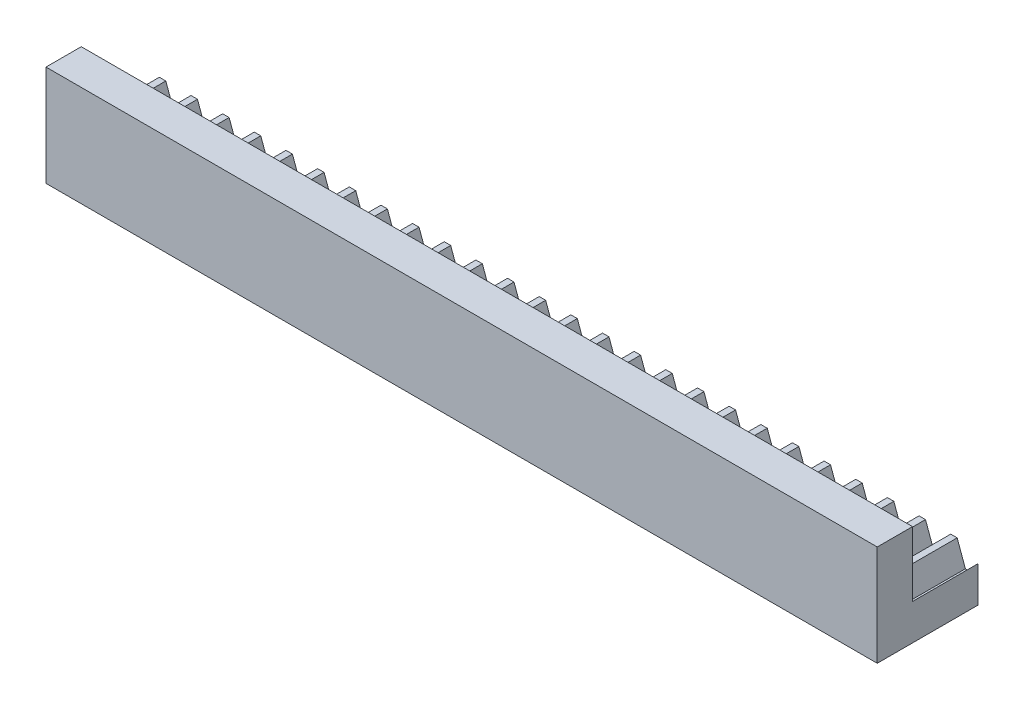
from build123d import *

# Parameters (mm, degrees)
BLANKSKE_W         = 165
BLANKSKE_H         = 9.5
BLANK_DEPTH        = 13
TOOTHCUTSIM_DEPTH  = 166.78374468
TEETHCUTS_COUNT    = 27
TEETHCUTS_PITCH    = 6.2831853
ESQUISSE1_W        = 165
ESQUISSE1_H        = 20
BOSS_EXTRU_1_DEPTH = 7


with BuildPart() as part:
    # BlankSke → Blank (new body)
    with BuildSketch(Plane.XY):
        with Locations((82.5, 4.75)):
            Rectangle(BLANKSKE_W, BLANKSKE_H)
    extrude(amount=-BLANK_DEPTH)

    # TooCutSkeSim → ToothCutSim (cut, through all)
    with BuildSketch(Plane.XY):
        Polygon((0.861870739, 5), (-0.861870739, 5), (-2.508981637, 9.5254), (2.508981637, 9.5254), align=None)
    toothcutsim = extrude(amount=-TOOTHCUTSIM_DEPTH, mode=Mode.SUBTRACT)

    # TeethCuts: ToothCutSim ×27
    with Locations(*[(i * TEETHCUTS_PITCH, 0, 0) for i in range(1, TEETHCUTS_COUNT)]):
        add(toothcutsim, mode=Mode.SUBTRACT)

    # Esquisse1 → Boss.-Extru.1 (add)
    with BuildSketch(Plane.XY):
        with Locations((82.5, 10)):
            Rectangle(ESQUISSE1_W, ESQUISSE1_H)
    extrude(amount=BOSS_EXTRU_1_DEPTH)


solid = part.part
